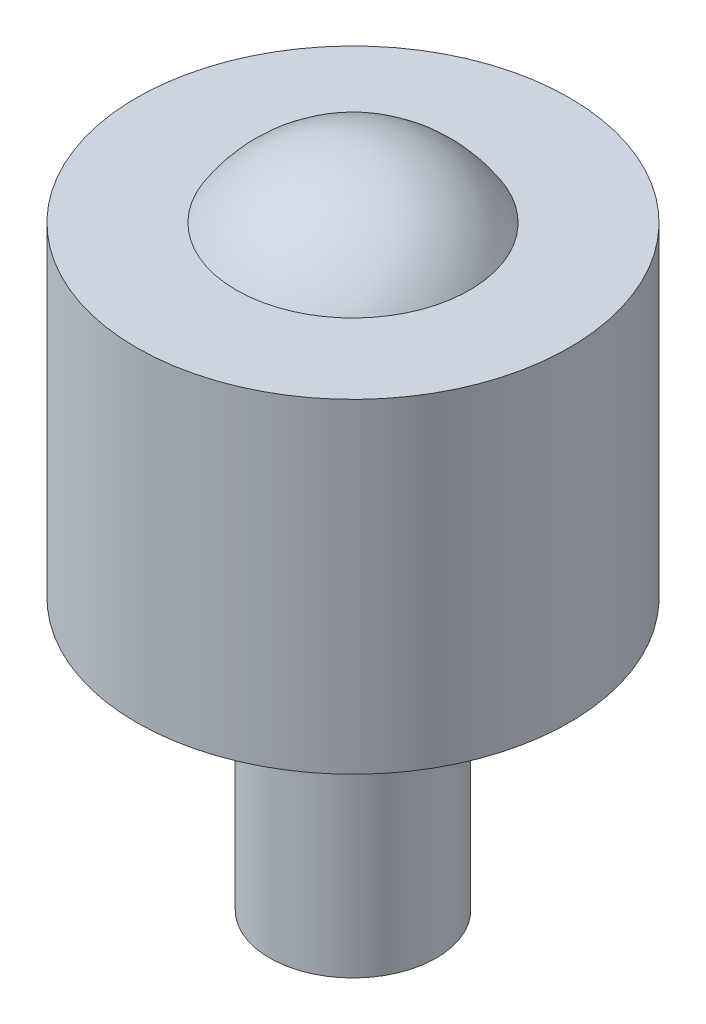
from build123d import *

# Parameters (mm, degrees)
ESQUISSE1_R        = 10
BOSS_EXTRU_1_DEPTH = 15
ESQUISSE3_R        = 3.85
BOSS_EXTRU_2_DEPTH = 12.5


with BuildPart() as part:
    # Esquisse1 → Boss.-Extru.1 (new body)
    with BuildSketch(Plane(origin=(0, 0, 0), x_dir=(1, 0, 0), z_dir=(0, 1, 0))):
        with Locations(Location((0, 0, 0), (0, 0, 270))):
            Circle(ESQUISSE1_R)
    extrude(amount=BOSS_EXTRU_1_DEPTH)

    # Esquisse3 → Boss.-Extru.2 (add)
    with BuildSketch(Plane.XZ):
        with Locations(Location((0, 0, 0), (0, 0, 270))):
            Circle(ESQUISSE3_R)
    extrude(amount=BOSS_EXTRU_2_DEPTH)


with BuildPart() as body_2:
    # Esquisse2 → Révolution6 (revolve)
    with BuildSketch(Plane(origin=(0, 0, 0), x_dir=(0, 0, -1), z_dir=(1, 0, 0))):
        with BuildLine():
            Line((0, 5.3), (0, 18))
            ThreePointArc((0, 18), (-6.35, 11.65), (0, 5.3))
        make_face()
    revolve(axis=Axis((0, 0, 0), (0, 1, 0)))


solid = Compound([part.part, body_2.part])
